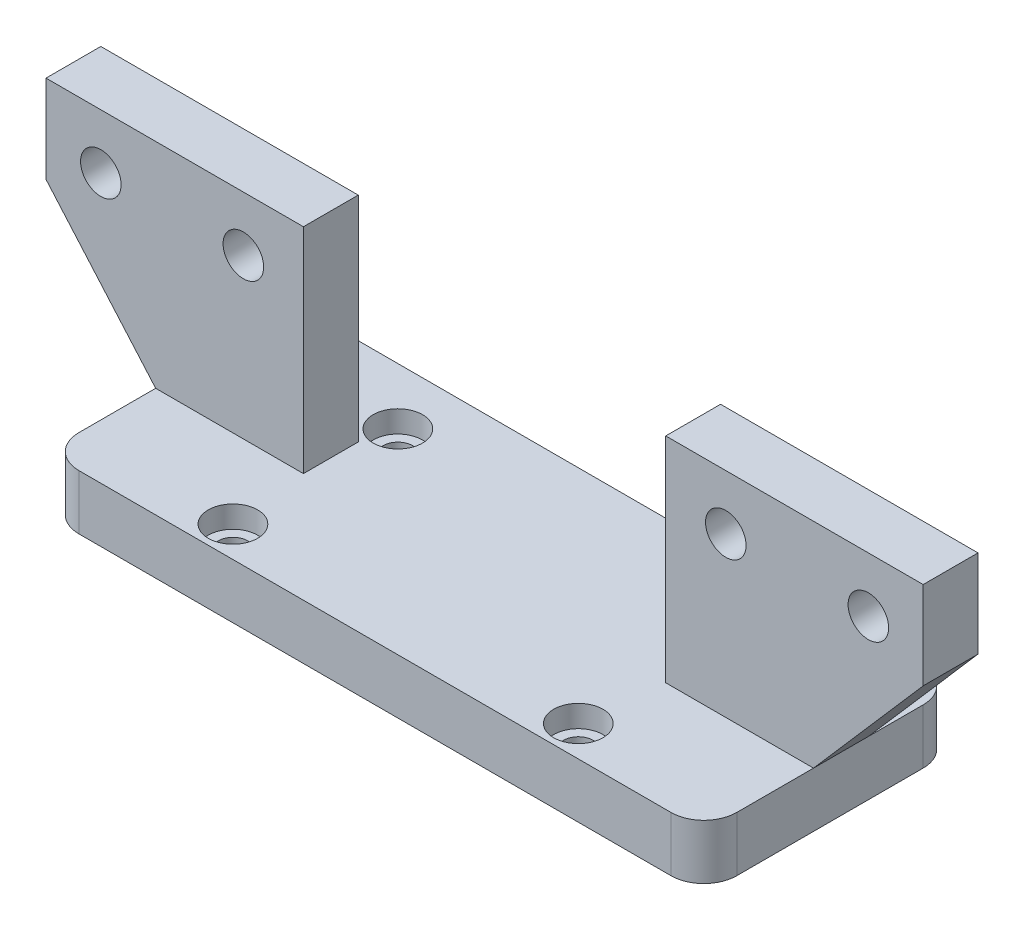
from build123d import *

# Parameters (mm, degrees)
SKETCH1_W           = 60
SKETCH1_H           = 23
BOSS_EXTRUDE1_DEPTH = 5
BOSS_EXTRUDE2_START = -10
SKETCH2_R           = 1.85
BOSS_EXTRUDE2_DEPTH = 5
SKETCH3_R           = 1.35
CUT_EXTRUDE1_DEPTH  = 49.295962564
SKETCH4_R           = 2.25
CUT_EXTRUDE2_DEPTH  = 2
FILLET1_R           = 3


with BuildPart() as part:
    # Sketch1 → Boss-Extrude1 (new body)
    with BuildSketch(Plane(origin=(0, 0, 0), x_dir=(1, 0, 0), z_dir=(0, 1, 0))):
        Rectangle(SKETCH1_W, SKETCH1_H)
    extrude(amount=BOSS_EXTRUDE1_DEPTH)

    # Sketch2 → Boss-Extrude2 (add)
    # profile 1 of 2: a face of its own
    with BuildSketch(Plane.XY.offset(11.5).offset(BOSS_EXTRUDE2_START)):
        Polygon((-40, 24.5), (-40, 16.5), (-30, 5), (-16.521636852, 5), (-16.521636852, 24.5), align=None)
        with Locations((-35, 19.5)):
            Circle(SKETCH2_R, mode=Mode.SUBTRACT)
        with Locations((-22, 19.5)):
            Circle(SKETCH2_R, mode=Mode.SUBTRACT)
    # profile 2 of 2: a face of its own
    with BuildSketch(Plane.XY.offset(11.5).offset(BOSS_EXTRUDE2_START)):
        Polygon((16.521636852, 24.5), (16.521636852, 5), (30, 5), (40, 16.5), (40, 24.5), align=None)
        with Locations((22, 19.5)):
            Circle(SKETCH2_R, mode=Mode.SUBTRACT)
        with Locations((35, 19.5)):
            Circle(SKETCH2_R, mode=Mode.SUBTRACT)
    extrude(amount=-BOSS_EXTRUDE2_DEPTH)

    # Sketch3 → Cut-Extrude1 (cut, through all)
    with BuildSketch(Plane.XZ):
        with Locations((-15.75, 8.7)):
            Circle(SKETCH3_R)
        with Locations((15.75, 8.7)):
            Circle(SKETCH3_R)
        with Locations((15.75, -6.34)):
            Circle(SKETCH3_R)
        with Locations((-15.75, -6.34)):
            Circle(SKETCH3_R)
    extrude(amount=-CUT_EXTRUDE1_DEPTH, mode=Mode.SUBTRACT)

    # Sketch4 → Cut-Extrude2 (cut)
    with BuildSketch(Plane(origin=(0, 5, 0), x_dir=(1, 0, 0), z_dir=(0, 1, 0))):
        with Locations((-15.75, 6.34)):
            Circle(SKETCH4_R)
        with Locations((15.75, 6.34)):
            Circle(SKETCH4_R)
        with Locations((15.75, -8.7)):
            Circle(SKETCH4_R)
        with Locations((-15.75, -8.7)):
            Circle(SKETCH4_R)
    extrude(amount=-CUT_EXTRUDE2_DEPTH, mode=Mode.SUBTRACT)

    # Fillet1
    fillet1_edges = [part.edges().sort_by_distance(p)[0] for p in [
        (30, 2.5, -11.5),
        (-30, 2.5, -11.5),
        (-30, 2.5, 11.5),
        (30, 2.5, 11.5),
    ]]
    fillet(fillet1_edges, radius=FILLET1_R)


solid = part.part
